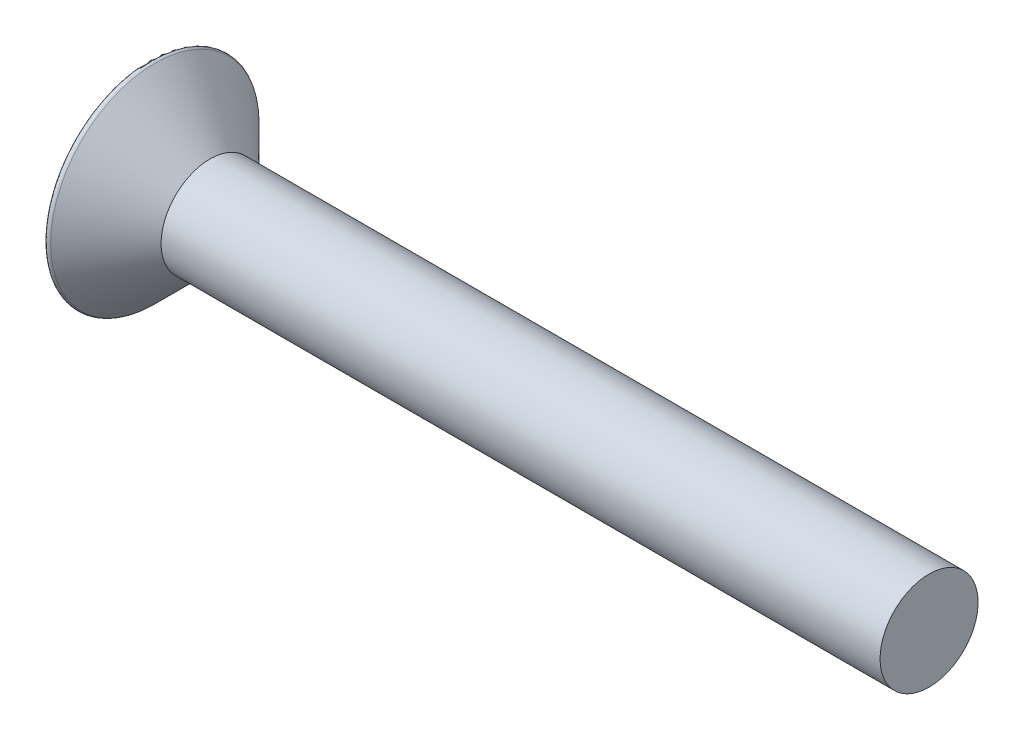
from build123d import *

# Parameters (mm, degrees)
CONG_1_R = 0.1


with BuildPart() as part:
    # Esquisse1 → Révolution1 (revolve)
    with BuildSketch(Plane.XY, mode=Mode.PRIVATE) as r_volution1_sk:
        Polygon((0, 0), (0, 3.36), (1.86, 1.5), (23.86, 1.5), (23.86, 0), align=None)
    revolve(r_volution1_sk.sketch.rotate(Axis((0, 0, 0), (1, 0, 0)), 90), axis=Axis((0, 0, 0), (1, 0, 0)))

    # Congé1
    cong_1_edges = [part.edges().sort_by_distance(p)[0] for p in [
        (0, 0, -3.36),
    ]]
    fillet(cong_1_edges, radius=CONG_1_R)


solid = part.part
